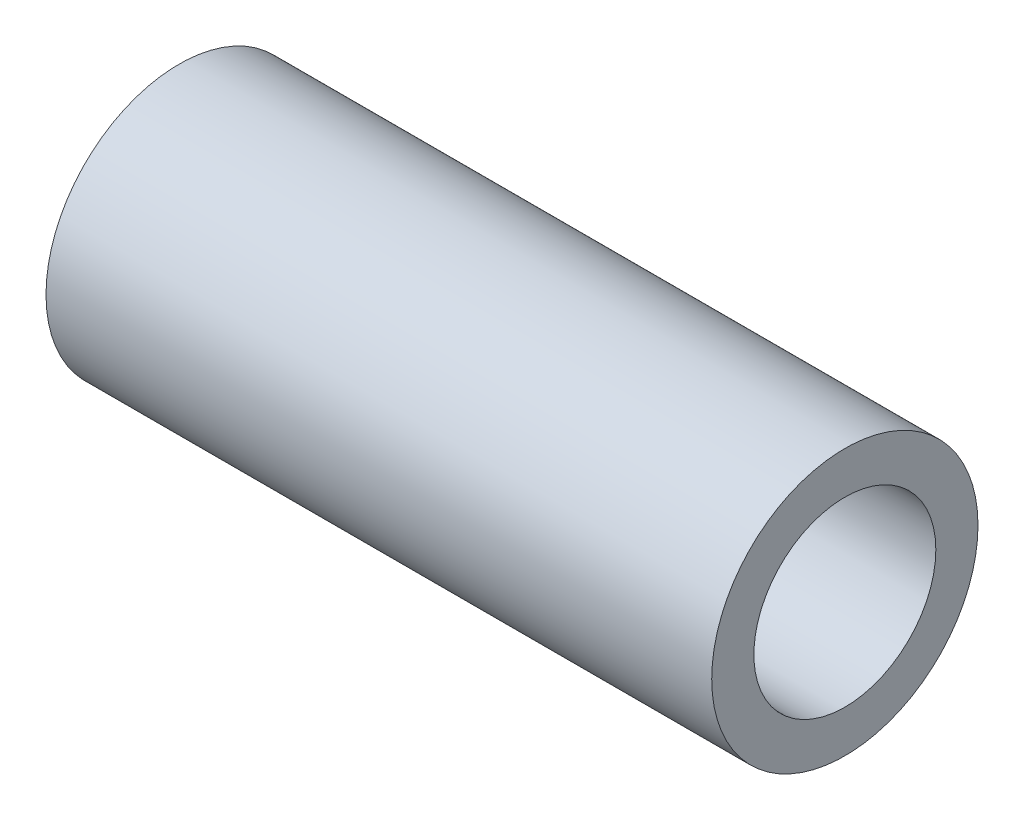
from build123d import *

# Parameters (mm, degrees)
SKETCH1_R           = 6
SKETCH1_R_2         = 4.1
BOSS_EXTRUDE1_DEPTH = 30


with BuildPart() as part:
    # Sketch1 → Boss-Extrude1 (new body)
    with BuildSketch(Plane.YZ):
        with Locations(Location((0, 0, 0), (0, 0, 270))):
            Circle(SKETCH1_R)
        with Locations(Location((0, 0, 0), (0, 0, 270))):
            Circle(SKETCH1_R_2, mode=Mode.SUBTRACT)
    extrude(amount=BOSS_EXTRUDE1_DEPTH)


solid = part.part
